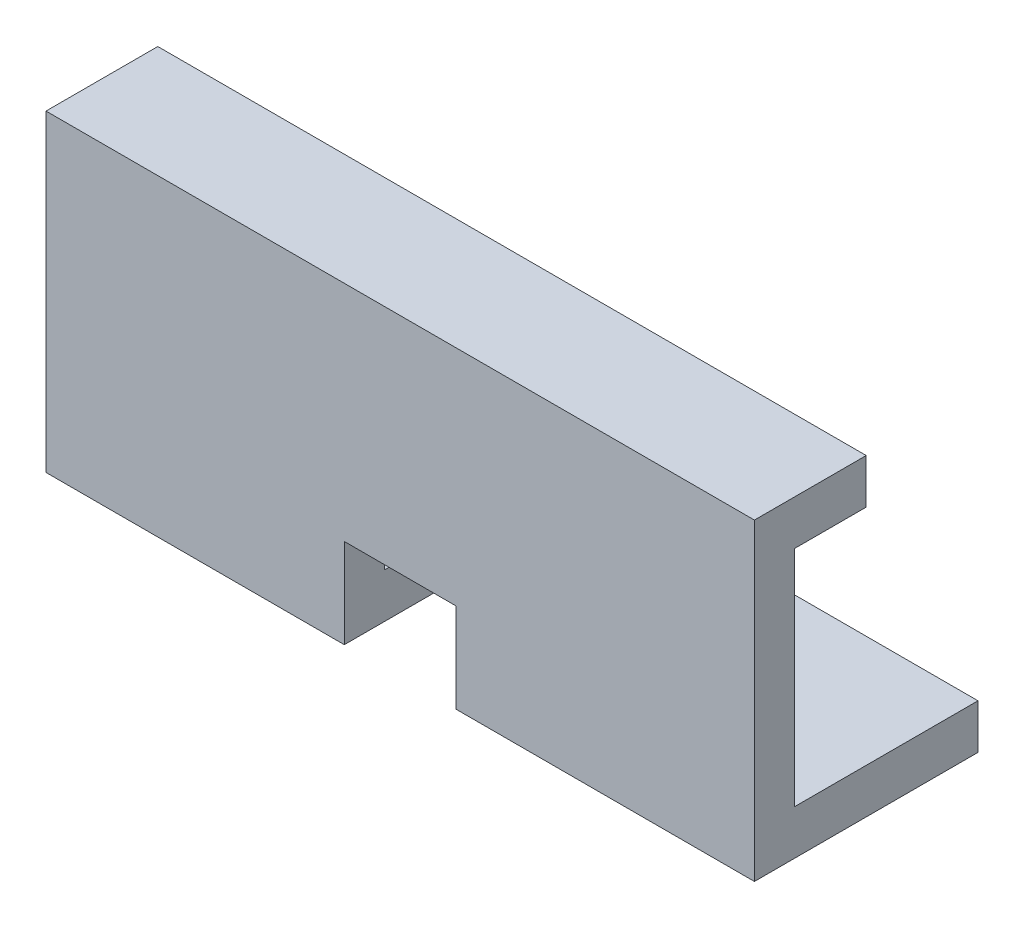
from build123d import *

# Parameters (mm, degrees)
CROQUIS2_W                 = 21.685111185
CROQUIS2_H                 = 10
CROQUIS2_R                 = 1.5
SALIENTE_EXTRUIR1_DEPTH    = 2
CROQUIS3_W                 = 21.685111185
CROQUIS3_H                 = 1.8
SALIENTE_EXTRUIR2_DEPTH    = 10
CORTAR_EXTRUIR1_DEPTH      = 2
CORTAR_EXTRUIR1_DEPTH_BACK = 10
CROQUIS4_W                 = 5
CROQUIS4_H                 = 5
CROQUIS7_W                 = 21.685111185
CROQUIS7_H                 = 5
SALIENTE_EXTRUIR4_DEPTH    = 2
SALIENTE_EXTRUIR5_DEPTH    = 5
SALIENTE_EXTRUIR6_DEPTH    = 5


with BuildPart() as part:
    # Croquis2 → Saliente-Extruir1 (new body)
    with BuildSketch(Plane(origin=(0, 0, 0), x_dir=(1, 0, 0), z_dir=(0, 1, 0))):
        with Locations((10.842555593, 5)):
            Rectangle(CROQUIS2_W, CROQUIS2_H)
        with Locations(Location((3.842555592, 5, 0), (0, 0, 270))):
            Circle(CROQUIS2_R, mode=Mode.SUBTRACT)
        with Locations(Location((17.842555592, 5, 0), (0, 0, 270))):
            Circle(CROQUIS2_R, mode=Mode.SUBTRACT)
    extrude(amount=SALIENTE_EXTRUIR1_DEPTH)

    # Croquis3 → Saliente-Extruir2 (add)
    with BuildSketch(Plane(origin=(0, 2, 0), x_dir=(1, 0, 0), z_dir=(0, 1, 0))):
        with Locations((10.842555593, 0.9)):
            Rectangle(CROQUIS3_W, CROQUIS3_H)
    extrude(amount=SALIENTE_EXTRUIR2_DEPTH)

    # Croquis4 → Cortar-Extruir1 (cut, two sides: drawn at the far end of the back side and taken through both)
    with BuildSketch(Plane(origin=(0, 2, 0), x_dir=(1, 0, 0), z_dir=(0, 1, 0)).offset(-CORTAR_EXTRUIR1_DEPTH_BACK)):
        with Locations((10.842555592, 2.5)):
            Rectangle(CROQUIS4_W, CROQUIS4_H)
    extrude(amount=CORTAR_EXTRUIR1_DEPTH + CORTAR_EXTRUIR1_DEPTH_BACK, mode=Mode.SUBTRACT)

    # Croquis7 → Saliente-Extruir4 (add)
    with BuildSketch(Plane(origin=(0, 12, 0), x_dir=(1, 0, 0), z_dir=(0, 1, 0))):
        with Locations((10.842555593, 2.5)):
            Rectangle(CROQUIS7_W, CROQUIS7_H)
    extrude(amount=SALIENTE_EXTRUIR4_DEPTH)

    # Croquis8 → Saliente-Extruir5 (add)
    with BuildSketch(Plane.ZY):
        Polygon((-10, 0), (0, 0), (0, 14), (-5, 14), (-5, 12), (-1.8, 12), (-1.8, 2), (-10, 2), align=None)
    extrude(amount=SALIENTE_EXTRUIR5_DEPTH)

    # Croquis9 → Saliente-Extruir6 (add)
    with BuildSketch(Plane(origin=(21.685111185, 0, 0), x_dir=(0, 0, -1), z_dir=(1, 0, 0))):
        Polygon((0, 0), (10, 0), (10, 2), (1.8, 2), (1.8, 12), (5, 12), (5, 14), (0, 14), align=None)
    extrude(amount=SALIENTE_EXTRUIR6_DEPTH)


solid = part.part
